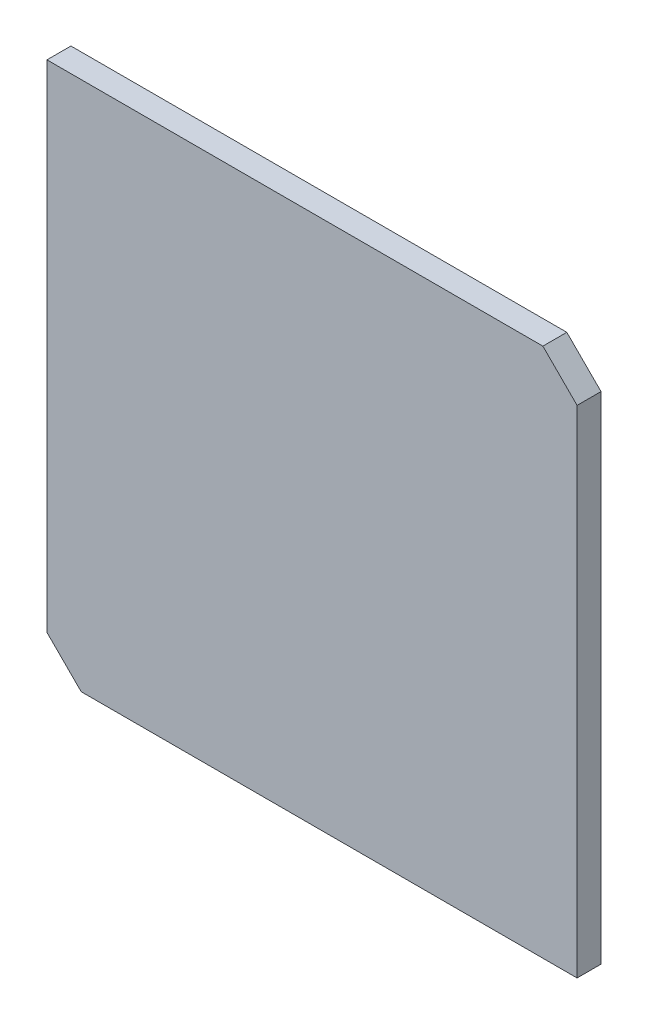
from build123d import *

# Parameters (mm, degrees)
EXTRUDE_1092_DEPTH = 14


with BuildPart() as part:
    # 草图1 → Extrude 1092 (new body)
    with BuildSketch(Plane.XY):
        Polygon((135, 155), (155, 135), (155, -155), (-135, -155), (-155, -135), (-155, 155), align=None)
    extrude(amount=EXTRUDE_1092_DEPTH)


solid = part.part
